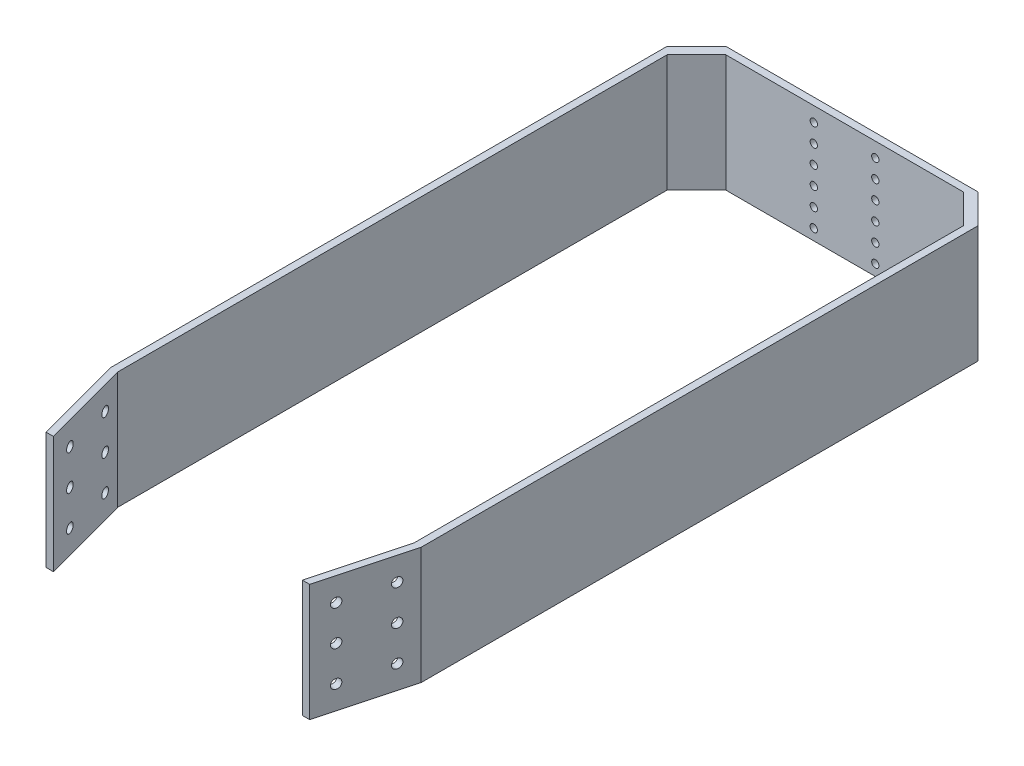
from build123d import *

# Parameters (mm, degrees)
BOSS_EXTRUDE1_DEPTH = 40
CUT_EXTRUDE1_REACH  = 259.317
SKETCH2_R           = 1.6
CUT_EXTRUDE2_REACH  = 241.402
SKETCH3_R           = 1.25
LPATTERN1_COUNT     = 6
LPATTERN1_PITCH     = 6.25
CHAMFER1_SIZE       = 10


with BuildPart() as part:
    # Sketch1 → Boss-Extrude1 (new body)
    with BuildSketch(Plane(origin=(0, 0, 0), x_dir=(1, 0, 0), z_dir=(0, 1, 0))):
        Polygon((-45, -230), (-53.038475773, -200), (-53.038475773, 0), (53.038475773, 0), (53.038475773, -200), (45, -230), (42.5, -230), (50.538475773, -200), (50.538475773, -2.5), (-50.538475773, -2.5), (-50.538475773, -200), (-42.5, -230), align=None)
    extrude(amount=BOSS_EXTRUDE1_DEPTH)

    # Sketch2 → Cut-Extrude1 (cut, up to next)
    with BuildSketch(Plane(origin=(-99.485571585, 0, 26.657078565), x_dir=(0.2588190451025251, 0, 0.9659258262890672), z_dir=(-0.9659258262890671, 0, 0.25881904510252507)), mode=Mode.PRIVATE) as cut_extrude1_sk1:
        with Locations((186.157797605, 32)):
            Circle(SKETCH2_R)
    cut_extrude1_tool1 = extrude(cut_extrude1_sk1.sketch, amount=-CUT_EXTRUDE1_REACH, mode=Mode.PRIVATE) & part.part
    # Sketch2 → Cut-Extrude1 (cut, up to next)
    with BuildSketch(Plane(origin=(-99.485571585, 0, 26.657078565), x_dir=(0.2588190451025251, 0, 0.9659258262890672), z_dir=(-0.9659258262890671, 0, 0.25881904510252507)), mode=Mode.PRIVATE) as cut_extrude1_sk2:
        with Locations((186.157797605, 8)):
            Circle(SKETCH2_R)
    cut_extrude1_tool2 = extrude(cut_extrude1_sk2.sketch, amount=-CUT_EXTRUDE1_REACH, mode=Mode.PRIVATE) & part.part
    # Sketch2 → Cut-Extrude1 (cut, up to next)
    with BuildSketch(Plane(origin=(-99.485571585, 0, 26.657078565), x_dir=(0.2588190451025251, 0, 0.9659258262890672), z_dir=(-0.9659258262890671, 0, 0.25881904510252507)), mode=Mode.PRIVATE) as cut_extrude1_sk3:
        with Locations((203.157797605, 8)):
            Circle(SKETCH2_R)
    cut_extrude1_tool3 = extrude(cut_extrude1_sk3.sketch, amount=-CUT_EXTRUDE1_REACH, mode=Mode.PRIVATE) & part.part
    # Sketch2 → Cut-Extrude1 (cut, up to next)
    with BuildSketch(Plane(origin=(-99.485571585, 0, 26.657078565), x_dir=(0.2588190451025251, 0, 0.9659258262890672), z_dir=(-0.9659258262890671, 0, 0.25881904510252507)), mode=Mode.PRIVATE) as cut_extrude1_sk4:
        with Locations((203.157797605, 32)):
            Circle(SKETCH2_R)
    cut_extrude1_tool4 = extrude(cut_extrude1_sk4.sketch, amount=-CUT_EXTRUDE1_REACH, mode=Mode.PRIVATE) & part.part
    # Sketch2 → Cut-Extrude1 (cut, up to next)
    with BuildSketch(Plane(origin=(-99.485571585, 0, 26.657078565), x_dir=(0.2588190451025251, 0, 0.9659258262890672), z_dir=(-0.9659258262890671, 0, 0.25881904510252507)), mode=Mode.PRIVATE) as cut_extrude1_sk5:
        with Locations((203.157797605, 20)):
            Circle(SKETCH2_R)
    cut_extrude1_tool5 = extrude(cut_extrude1_sk5.sketch, amount=-CUT_EXTRUDE1_REACH, mode=Mode.PRIVATE) & part.part
    # Sketch2 → Cut-Extrude1 (cut, up to next)
    with BuildSketch(Plane(origin=(-99.485571585, 0, 26.657078565), x_dir=(0.2588190451025251, 0, 0.9659258262890672), z_dir=(-0.9659258262890671, 0, 0.25881904510252507)), mode=Mode.PRIVATE) as cut_extrude1_sk6:
        with Locations((186.157797605, 20)):
            Circle(SKETCH2_R)
    cut_extrude1_tool6 = extrude(cut_extrude1_sk6.sketch, amount=-CUT_EXTRUDE1_REACH, mode=Mode.PRIVATE) & part.part
    cut_extrude1_1 = cut_extrude1_tool1.solids().sort_by_distance((-51.304388, 32, 206.471703))[0]
    add(cut_extrude1_1, mode=Mode.SUBTRACT)
    cut_extrude1_2 = cut_extrude1_tool2.solids().sort_by_distance((-51.304388, 8, 206.471703))[0]
    add(cut_extrude1_2, mode=Mode.SUBTRACT)
    cut_extrude1_3 = cut_extrude1_tool3.solids().sort_by_distance((-46.904464, 8, 222.892442))[0]
    add(cut_extrude1_3, mode=Mode.SUBTRACT)
    cut_extrude1_4 = cut_extrude1_tool4.solids().sort_by_distance((-46.904464, 32, 222.892442))[0]
    add(cut_extrude1_4, mode=Mode.SUBTRACT)
    cut_extrude1_5 = cut_extrude1_tool5.solids().sort_by_distance((-46.904464, 20, 222.892442))[0]
    add(cut_extrude1_5, mode=Mode.SUBTRACT)
    cut_extrude1_6 = cut_extrude1_tool6.solids().sort_by_distance((-51.304388, 20, 206.471703))[0]
    add(cut_extrude1_6, mode=Mode.SUBTRACT)
    cut_extrude1 = cut_extrude1_1 + cut_extrude1_2 + cut_extrude1_3 + cut_extrude1_4 + cut_extrude1_5 + cut_extrude1_6  # Cut-Extrude1 as one shape, for the pattern or mirror that repeats it

    # Mirror1: Cut-Extrude1 across plane
    add(cut_extrude1.mirror(Plane(origin=(0, 0, 0), x_dir=(0, 0, 1), z_dir=(1, 0, 0))), mode=Mode.SUBTRACT)

    # Sketch3 → Cut-Extrude2 (cut, up to next)
    with BuildSketch(Plane(origin=(0, 0, 0), x_dir=(-1, 0, 0), z_dir=(0, 0, -1)), mode=Mode.PRIVATE) as cut_extrude2_sk1:
        with Locations((-10.5, 35)):
            Circle(SKETCH3_R)
    cut_extrude2_tool1 = extrude(cut_extrude2_sk1.sketch, amount=-CUT_EXTRUDE2_REACH, mode=Mode.PRIVATE) & part.part
    # Sketch3 → Cut-Extrude2 (cut, up to next)
    with BuildSketch(Plane(origin=(0, 0, 0), x_dir=(-1, 0, 0), z_dir=(0, 0, -1)), mode=Mode.PRIVATE) as cut_extrude2_sk2:
        with Locations((10.5, 35)):
            Circle(SKETCH3_R)
    cut_extrude2_tool2 = extrude(cut_extrude2_sk2.sketch, amount=-CUT_EXTRUDE2_REACH, mode=Mode.PRIVATE) & part.part
    cut_extrude2_1 = cut_extrude2_tool1.solids().sort_by_distance((10.5, 35, 0))[0]
    add(cut_extrude2_1, mode=Mode.SUBTRACT)
    cut_extrude2_2 = cut_extrude2_tool2.solids().sort_by_distance((-10.5, 35, 0))[0]
    add(cut_extrude2_2, mode=Mode.SUBTRACT)
    cut_extrude2 = cut_extrude2_1 + cut_extrude2_2  # Cut-Extrude2 as one shape, for the pattern or mirror that repeats it

    # LPattern1: Cut-Extrude2 ×6
    with Locations(*[(0, -i * LPATTERN1_PITCH, 0) for i in range(1, LPATTERN1_COUNT)]):
        add(cut_extrude2, mode=Mode.SUBTRACT)

    # Chamfer1
    chamfer1_edges = [part.edges().sort_by_distance(p)[0] for p in [
        (-53.038475773, 20, 0),
        (53.038475773, 20, 0),
        (50.538475773, 20, 2.5),
        (-50.538475773, 20, 2.5),
    ]]
    chamfer(chamfer1_edges, length=CHAMFER1_SIZE)


solid = part.part
